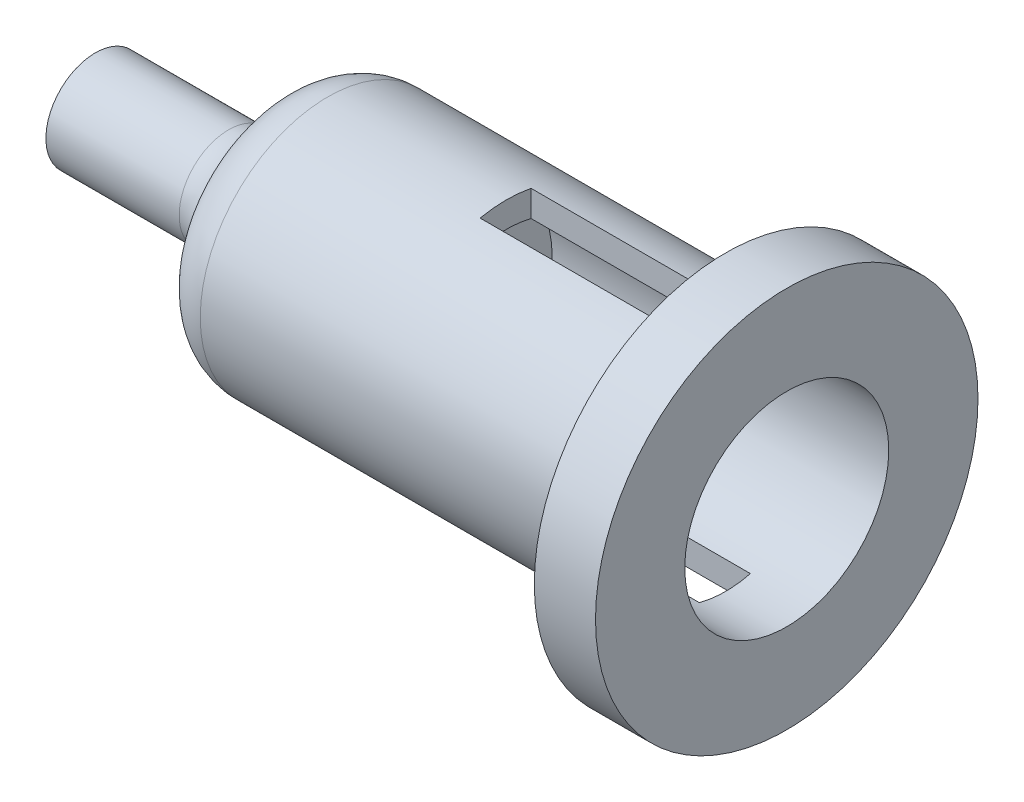
from build123d import *

# Parameters (mm, degrees)
FILLET1_R               = 10
FILLET2_R               = 10
CUT_EXTRUDE1_DEPTH      = 113.630542396
CUT_EXTRUDE1_DEPTH_BACK = 113.630542396
SKETCH2_W               = 43
SKETCH2_H               = 10


with BuildPart() as part:
    # Sketch1 → Revolve1 (revolve)
    with BuildSketch(Plane(origin=(0, 0, 0), x_dir=(1, 0, 0), z_dir=(0, 1, 0))):
        Polygon((-99.363670728, 9.691024676), (-63.789023183, 9.691024676), (-63.789023183, 25), (24.210976817, 25), (24.210976817, 37.5), (36.210976817, 37.5), (36.210976817, 20), (-29.789023183, 20), (-29.789023183, 0), (-99.363670728, 0), align=None)
    revolve(axis=Axis((-29.789023183, 0, 0), (-1, 0, 0)))

    # Fillet1
    fillet1_edges = [part.edges().sort_by_distance(p)[0] for p in [
        (-63.789023183, 0, 25),
    ]]
    fillet(fillet1_edges, radius=FILLET1_R)

    # Fillet2
    fillet2_edges = [part.edges().sort_by_distance(p)[0] for p in [
        (-63.789023183, 0, 9.691024676),
    ]]
    fillet(fillet2_edges, radius=FILLET2_R)

    # Sketch2 → Cut-Extrude1 (cut, two sides: drawn at the far end of the back side and taken through both)
    with BuildSketch(Plane(origin=(0, 0, 0), x_dir=(1, 0, 0), z_dir=(0, 1, 0)).offset(-CUT_EXTRUDE1_DEPTH_BACK)):
        with Locations((2.710976817, -0.126659564)):
            Rectangle(SKETCH2_W, SKETCH2_H)
    extrude(amount=CUT_EXTRUDE1_DEPTH + CUT_EXTRUDE1_DEPTH_BACK, mode=Mode.SUBTRACT)


solid = part.part
